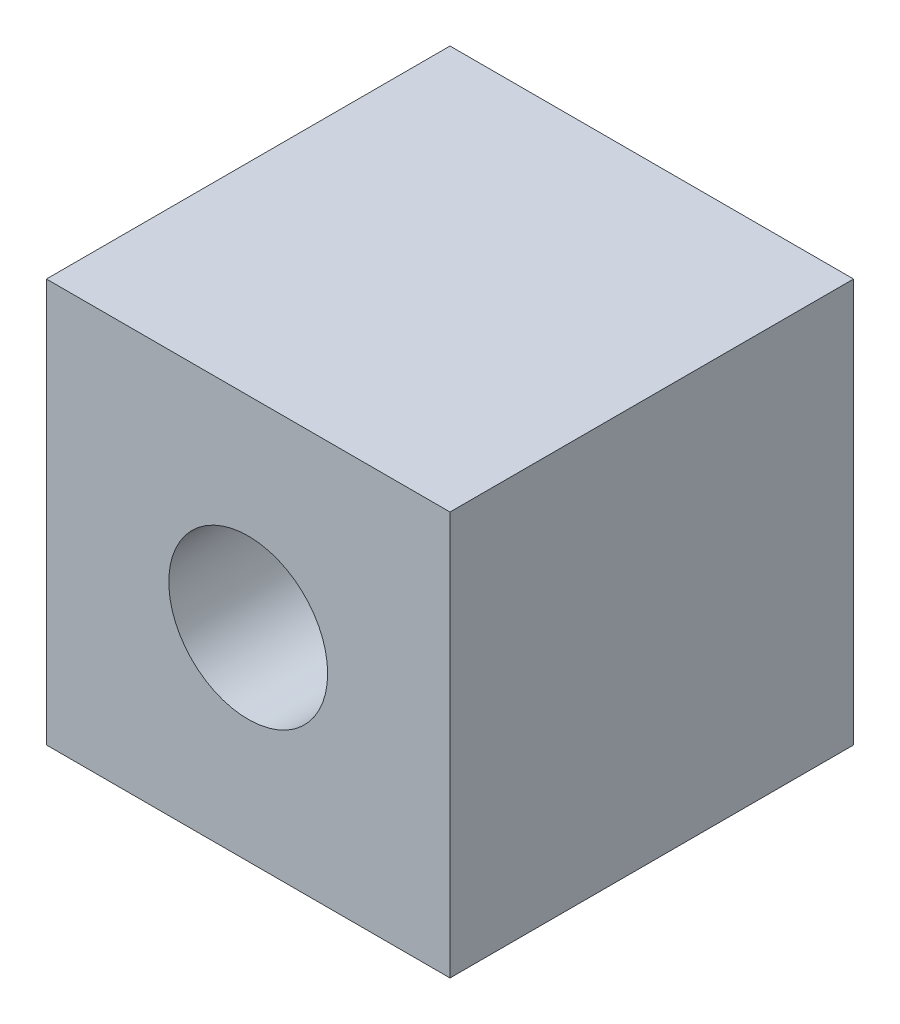
from build123d import *

# Parameters (mm, degrees)
SKETCH2_W           = 12.7
SKETCH2_H           = 12.7
BOSS_EXTRUDE1_DEPTH = 12.7
SKETCH3_R           = 2.5
CUT_EXTRUDE1_DEPTH  = 6.35


with BuildPart() as part:
    # Sketch2 → Boss-Extrude1 (new body)
    with BuildSketch(Plane(origin=(0, 0, 0), x_dir=(1, 0, 0), z_dir=(0, 1, 0))):
        Rectangle(SKETCH2_W, SKETCH2_H)
    extrude(amount=BOSS_EXTRUDE1_DEPTH)

    # Sketch3 → Cut-Extrude1 (cut)
    with BuildSketch(Plane.XY.offset(6.35)):
        with Locations((0, 6.373493799)):
            Circle(SKETCH3_R)
    extrude(amount=-CUT_EXTRUDE1_DEPTH, mode=Mode.SUBTRACT)


solid = part.part
